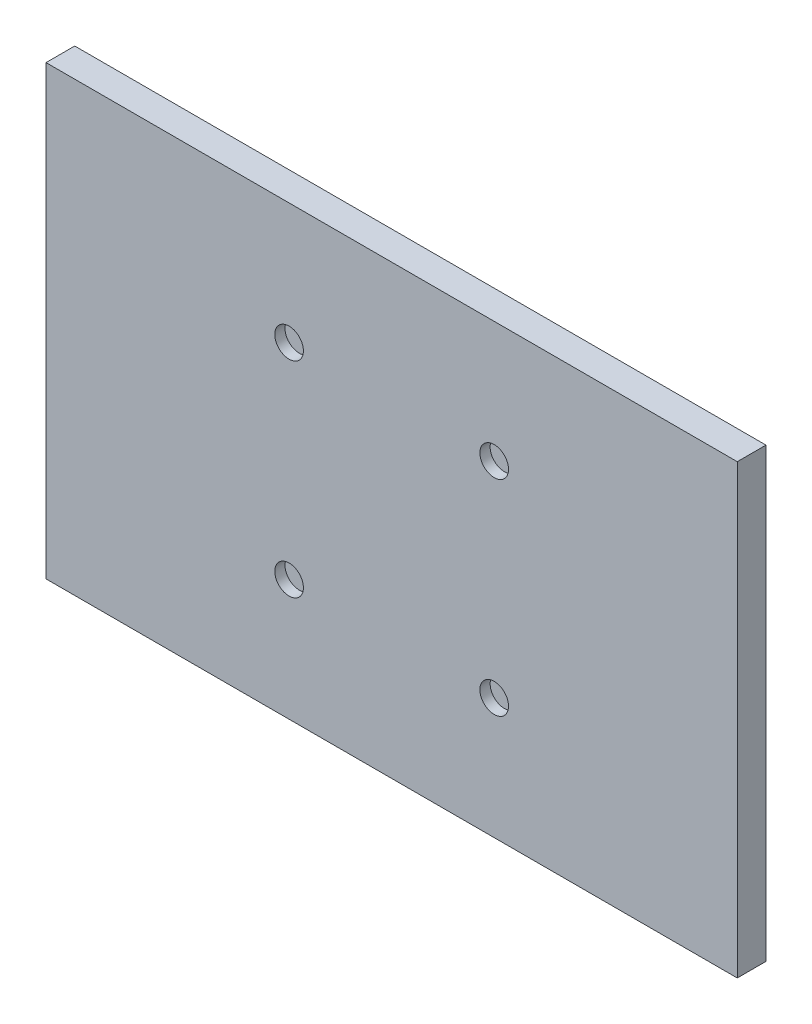
from build123d import *

# Parameters (mm, degrees)
SKETCH1_W           = 168.5
SKETCH1_H           = 109
BOSS_EXTRUDE1_DEPTH = 7
SKETCH2_R           = 3.493429644
CUT_EXTRUDE1_DEPTH  = 2.5


with BuildPart() as part:
    # Sketch1 → Boss-Extrude1 (new body)
    with BuildSketch(Plane(origin=(0, 0, 0), x_dir=(-1, 0, 0), z_dir=(0, 0, 1))):
        with Locations((0, -15.7805)):
            Rectangle(SKETCH1_W, SKETCH1_H)
    extrude(amount=BOSS_EXTRUDE1_DEPTH)

    # Sketch2 → Cut-Extrude1 (cut)
    with BuildSketch(Plane.XY.offset(7)):
        with Locations((25, 40.7805)):
            Circle(SKETCH2_R)
        with Locations((-25, 40.7805)):
            Circle(SKETCH2_R)
        with Locations((-25, -9.2195)):
            Circle(SKETCH2_R)
        with Locations((25, -9.2195)):
            Circle(SKETCH2_R)
    cut_extrude1 = extrude(amount=-CUT_EXTRUDE1_DEPTH, mode=Mode.SUBTRACT)

    # Mirror1: Cut-Extrude1 across plane
    add(cut_extrude1.mirror(Plane.XY.offset(3.5)), mode=Mode.SUBTRACT)


solid = part.part
